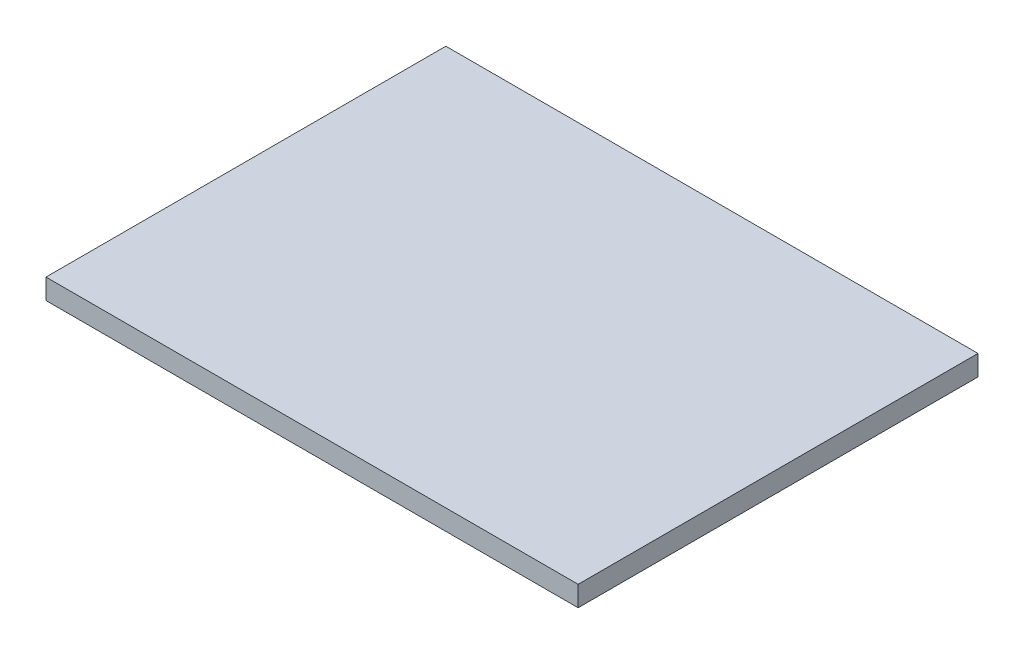
from build123d import *

# Parameters (mm, degrees)
SKETCH3_W           = 2615
SKETCH3_H           = 1965
BOSS_EXTRUDE1_DEPTH = 100


with BuildPart() as part:
    # Sketch3 → Boss-Extrude1 (new body)
    with BuildSketch(Plane(origin=(0, 0, 0), x_dir=(1, 0, 0), z_dir=(0, 1, 0))):
        with Locations((1307.5, 982.5)):
            Rectangle(SKETCH3_W, SKETCH3_H)
    extrude(amount=BOSS_EXTRUDE1_DEPTH)


solid = part.part
